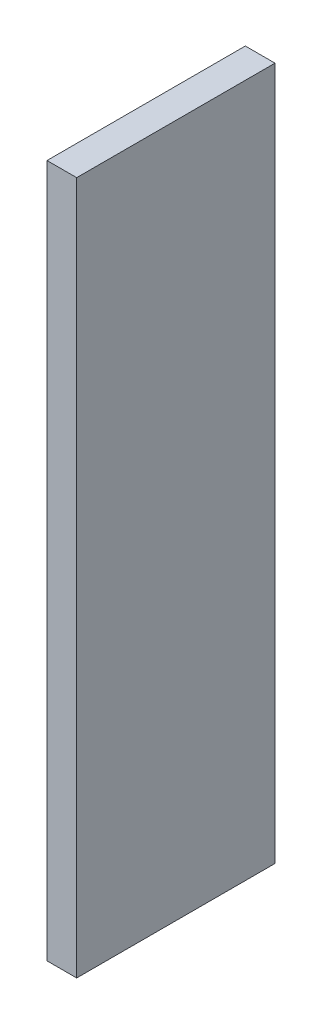
from build123d import *

# Parameters (mm, degrees)
BOSS_EXTRUDE1_DEPTH = 3


with BuildPart() as part:
    # Sketch1 → Boss-Extrude1 (new body)
    with BuildSketch(Plane(origin=(0, 0, 0), x_dir=(0, 0, -1), z_dir=(1, 0, 0))):
        Polygon((20.042546164, 0), (20.042546164, 6.463925393), (20.042546164, 70.042546164), (0, 70.042546164), (0, 0), align=None)
    extrude(amount=BOSS_EXTRUDE1_DEPTH)


solid = part.part
